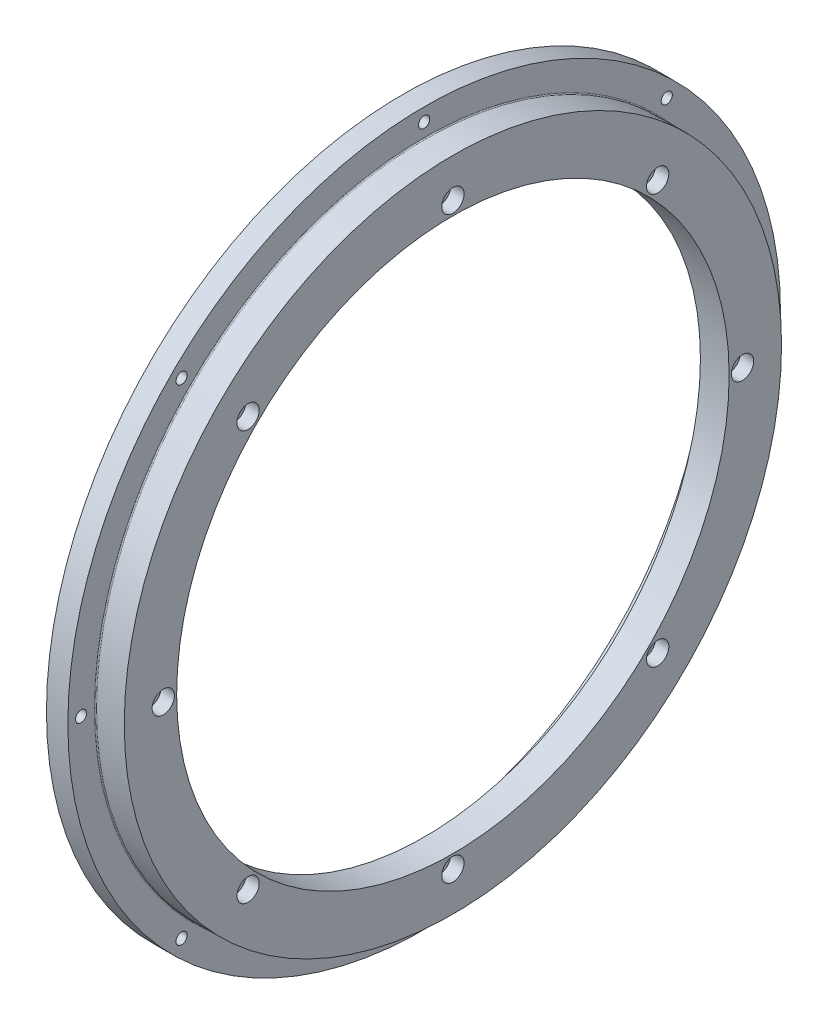
from build123d import *

# Parameters (mm, degrees)
FILLET1_R          = 0.762
FILLET2_R          = 0.762
CUT_EXTRUDE2_START = -17.8562
SKETCH2_R          = 3.96875
CUT_EXTRUDE2_DEPTH = 35.7124
CUT_EXTRUDE4_START = 17.8562
SKETCH3_R          = 5.1562
CUT_EXTRUDE4_DEPTH = 35.7124
CUT_EXTRUDE6_START = 17.8562
SKETCH4_R          = 7.9375
CUT_EXTRUDE6_DEPTH = 9.525


with BuildPart() as part:
    # Sketch1 → Revolve1 (revolve)
    with BuildSketch(Plane(origin=(0, 0, 0), x_dir=(1, 0, 0), z_dir=(0, 1, 0)), mode=Mode.PRIVATE) as revolve1_sk:
        Polygon((-17.8562, 253.9111), (-2.6162, 253.9111), (-2.6162, 234.188), (17.8562, 234.188), (17.8562, 196.85), (-2.6162, 196.85), (-2.6162, 215.9127), (-17.8562, 215.9127), align=None)
    revolve(revolve1_sk.sketch.rotate(Axis((-43.2562, 0, 0), (1, 0, 0)), 180), axis=Axis((-43.2562, 0, 0), (1, 0, 0)))

    # Fillet1
    fillet1_edges = [part.edges().sort_by_distance(p)[0] for p in [
        (-2.6162, 0, -234.188),
    ]]
    fillet(fillet1_edges, radius=FILLET1_R)

    # Fillet2
    fillet2_edges = [part.edges().sort_by_distance(p)[0] for p in [
        (-2.6162, 0, -215.9127),
    ]]
    fillet(fillet2_edges, radius=FILLET2_R)

    # Sketch2 → Cut-Extrude2 (cut)
    with BuildSketch(Plane(origin=(0, 0, 0), x_dir=(0, 0, -1), z_dir=(1, 0, 0)).offset(CUT_EXTRUDE2_START)):
        with Locations(Location((244.475, 0, 0), (0, 0, 180))):
            Circle(SKETCH2_R)
        with Locations(Location((172.8699362, 172.8699362, 0), (0, 0, 180))):
            Circle(SKETCH2_R)
        with Locations(Location((0, 244.475, 0), (0, 0, 180))):
            Circle(SKETCH2_R)
        with Locations(Location((-172.8699362, 172.8699362, 0), (0, 0, 180))):
            Circle(SKETCH2_R)
        with Locations(Location((-244.475, 0, 0), (0, 0, 180))):
            Circle(SKETCH2_R)
        with Locations(Location((-172.8699362, -172.8699362, 0), (0, 0, 180))):
            Circle(SKETCH2_R)
        with Locations(Location((0, -244.475, 0), (0, 0, 180))):
            Circle(SKETCH2_R)
        with Locations(Location((172.8699362, -172.8699362, 0), (0, 0, 180))):
            Circle(SKETCH2_R)
    extrude(amount=CUT_EXTRUDE2_DEPTH, mode=Mode.SUBTRACT)

    # Sketch3 → Cut-Extrude4 (cut)
    with BuildSketch(Plane(origin=(0, 0, 0), x_dir=(0, 0, -1), z_dir=(1, 0, 0)).offset(CUT_EXTRUDE4_START)):
        with Locations((206.375, 0)):
            Circle(SKETCH3_R)
        with Locations((145.9291722, 145.9291722)):
            Circle(SKETCH3_R)
        with Locations((0, 206.375)):
            Circle(SKETCH3_R)
        with Locations((-145.9291722, 145.9291722)):
            Circle(SKETCH3_R)
        with Locations((-206.375, 0)):
            Circle(SKETCH3_R)
        with Locations((-145.9291722, -145.9291722)):
            Circle(SKETCH3_R)
        with Locations((0, -206.375)):
            Circle(SKETCH3_R)
        with Locations((145.9291722, -145.9291722)):
            Circle(SKETCH3_R)
    extrude(amount=-CUT_EXTRUDE4_DEPTH, mode=Mode.SUBTRACT)

    # Sketch4 → Cut-Extrude6 (cut)
    with BuildSketch(Plane(origin=(0, 0, 0), x_dir=(0, 0, -1), z_dir=(1, 0, 0)).offset(CUT_EXTRUDE6_START)):
        with Locations((206.375, 0)):
            Circle(SKETCH4_R)
        with Locations((145.9291722, 145.9291722)):
            Circle(SKETCH4_R)
        with Locations((0, 206.375)):
            Circle(SKETCH4_R)
        with Locations((-145.9291722, 145.9291722)):
            Circle(SKETCH4_R)
        with Locations((-206.375, 0)):
            Circle(SKETCH4_R)
        with Locations((-145.9291722, -145.9291722)):
            Circle(SKETCH4_R)
        with Locations((0, -206.375)):
            Circle(SKETCH4_R)
        with Locations((145.9291722, -145.9291722)):
            Circle(SKETCH4_R)
    extrude(amount=-CUT_EXTRUDE6_DEPTH, mode=Mode.SUBTRACT)


solid = part.part
